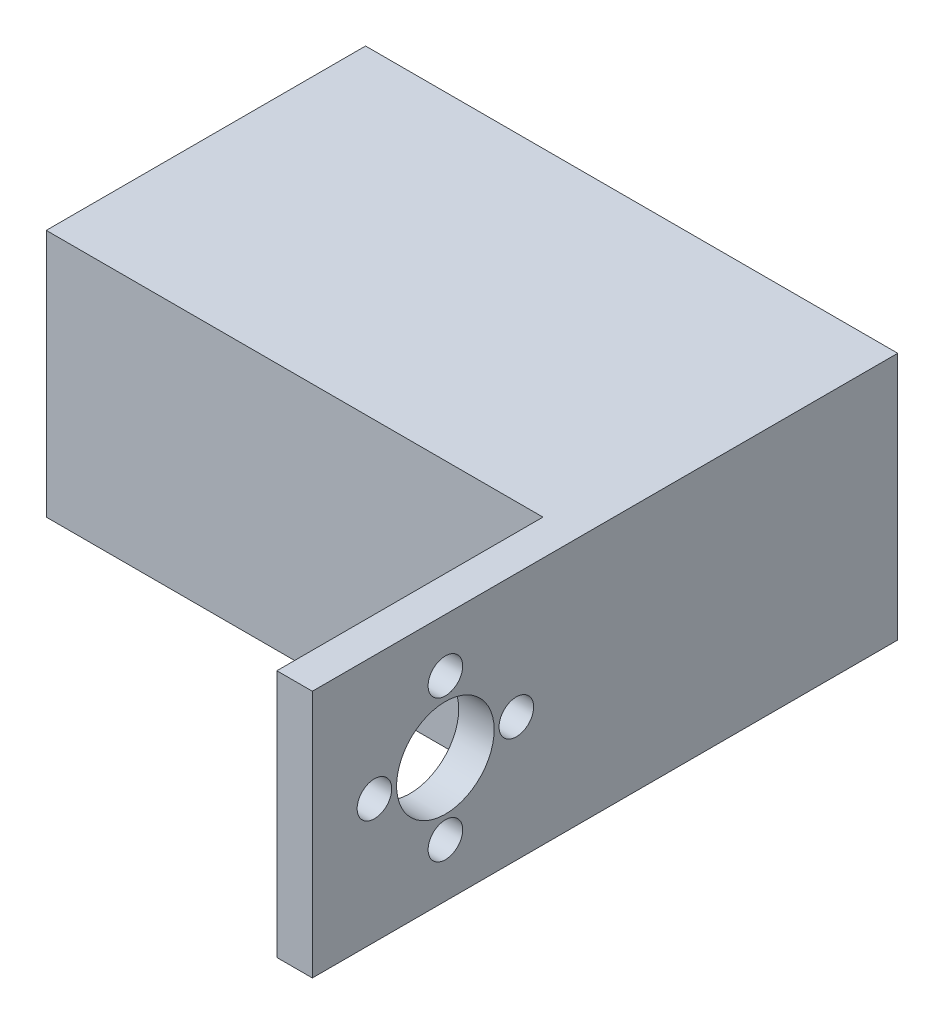
from build123d import *

# Parameters (mm, degrees)
SKETCH1_W           = 60
SKETCH1_H           = 28
SKETCH1_W_2         = 40
SKETCH1_H_2         = 20
BOSS_EXTRUDE1_DEPTH = 32
SKETCH2_W           = 60
SKETCH2_H           = 28
BOSS_EXTRUDE2_DEPTH = 4
SKETCH3_W           = 30
SKETCH3_H           = 28
SKETCH3_R           = 5.5
BOSS_EXTRUDE3_DEPTH = 4
SKETCH4_R           = 1.95
CUT_EXTRUDE1_DEPTH  = 4
SKETCH5_R           = 2.2
CUT_EXTRUDE2_DEPTH  = 15


with BuildPart() as part:
    # Sketch1 → Boss-Extrude1 (new body)
    with BuildSketch(Plane.XY):
        with Locations((20, -10)):
            Rectangle(SKETCH1_W, SKETCH1_H)
        with Locations((20, -10)):
            Rectangle(SKETCH1_W_2, SKETCH1_H_2, mode=Mode.SUBTRACT)
    extrude(amount=BOSS_EXTRUDE1_DEPTH)

    # Sketch2 → Boss-Extrude2 (add)
    with BuildSketch(Plane.XY.offset(32)):
        with Locations((20, -10)):
            Rectangle(SKETCH2_W, SKETCH2_H)
    extrude(amount=BOSS_EXTRUDE2_DEPTH)

    # Sketch3 → Boss-Extrude3 (add)
    with BuildSketch(Plane(origin=(50, 0, 0), x_dir=(0, 0, -1), z_dir=(1, 0, 0))):
        with Locations((-51, -10)):
            Rectangle(SKETCH3_W, SKETCH3_H)
        with Locations((-51, -10)):
            Circle(SKETCH3_R, mode=Mode.SUBTRACT)
    extrude(amount=-BOSS_EXTRUDE3_DEPTH)

    # Sketch4 → Cut-Extrude1 (cut)
    with BuildSketch(Plane(origin=(50, 0, 0), x_dir=(0, 0, -1), z_dir=(1, 0, 0))):
        with Locations((-51, -18)):
            Circle(SKETCH4_R)
        with Locations((-59, -10)):
            Circle(SKETCH4_R)
        with Locations((-43, -10)):
            Circle(SKETCH4_R)
        with Locations((-51, -2)):
            Circle(SKETCH4_R)
    extrude(amount=-CUT_EXTRUDE1_DEPTH, mode=Mode.SUBTRACT)

    # Sketch5 → Cut-Extrude2 (cut)
    with BuildSketch(Plane(origin=(0, 0, 0), x_dir=(-1, 0, 0), z_dir=(0, 0, -1))):
        with Locations((-44.4, -5)):
            Circle(SKETCH5_R)
        with Locations((-44.4, -15)):
            Circle(SKETCH5_R)
        with Locations((4.4, -5)):
            Circle(SKETCH5_R)
        with Locations((4.4, -15)):
            Circle(SKETCH5_R)
    extrude(amount=-CUT_EXTRUDE2_DEPTH, mode=Mode.SUBTRACT)


solid = part.part
